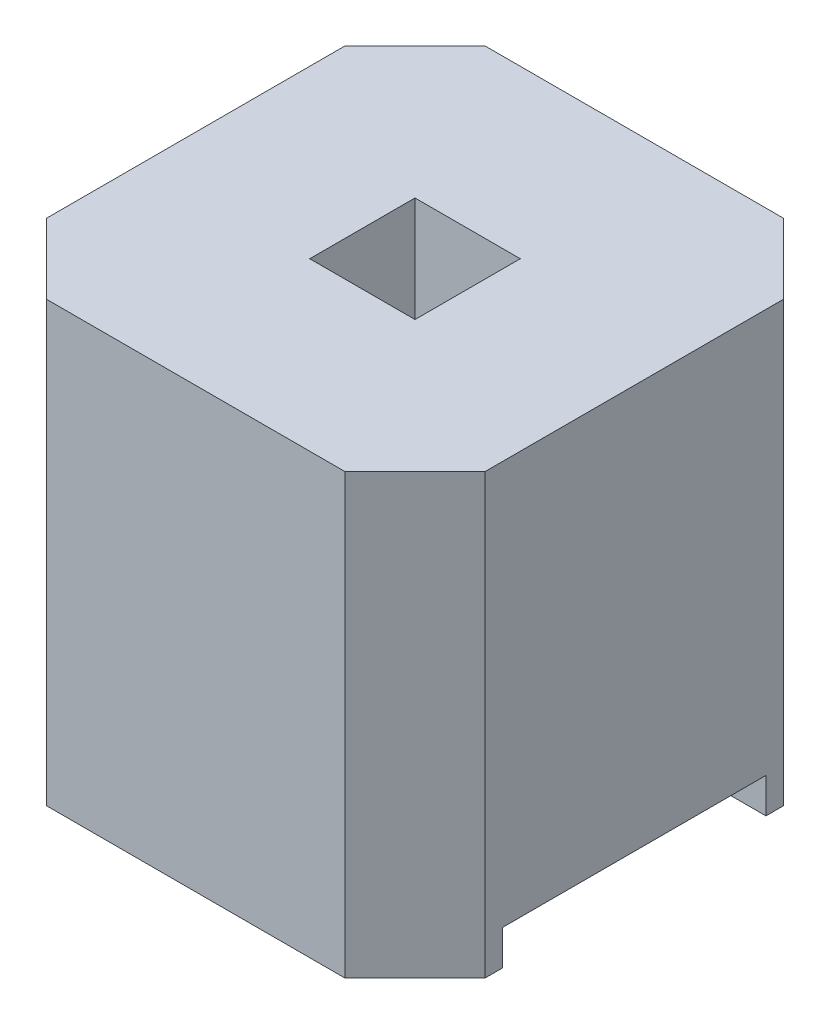
from build123d import *

# Parameters (mm, degrees)
ESQUISSE1_W             = 0.6
ESQUISSE1_H             = 0.6
BOSS_EXTRU_1_DEPTH      = 2.5
ESQUISSE2_W             = 1.5
ESQUISSE2_H             = 0.4
ENL_V_MAT_EXTRU_1_DEPTH = 4.75


with BuildPart() as part:
    # Esquisse1 → Boss.-Extru.1 (new body)
    with BuildSketch(Plane(origin=(0, 0, 0), x_dir=(1, 0, 0), z_dir=(0, 1, 0))):
        Polygon((-1.25, 0.85), (-0.85, 1.25), (0.85, 1.25), (1.25, 0.85), (1.25, -0.85), (0.85, -1.25), (-0.85, -1.25), (-1.25, -0.85), align=None)
        Rectangle(ESQUISSE1_W, ESQUISSE1_H, mode=Mode.SUBTRACT)
    extrude(amount=BOSS_EXTRU_1_DEPTH)

    # Esquisse2 → Enlèv. mat.-Extru.1 (cut, through all)
    with BuildSketch(Plane.ZY.offset(1.25)):
        Rectangle(ESQUISSE2_W, ESQUISSE2_H)
    extrude(amount=-ENL_V_MAT_EXTRU_1_DEPTH, mode=Mode.SUBTRACT)


solid = part.part
